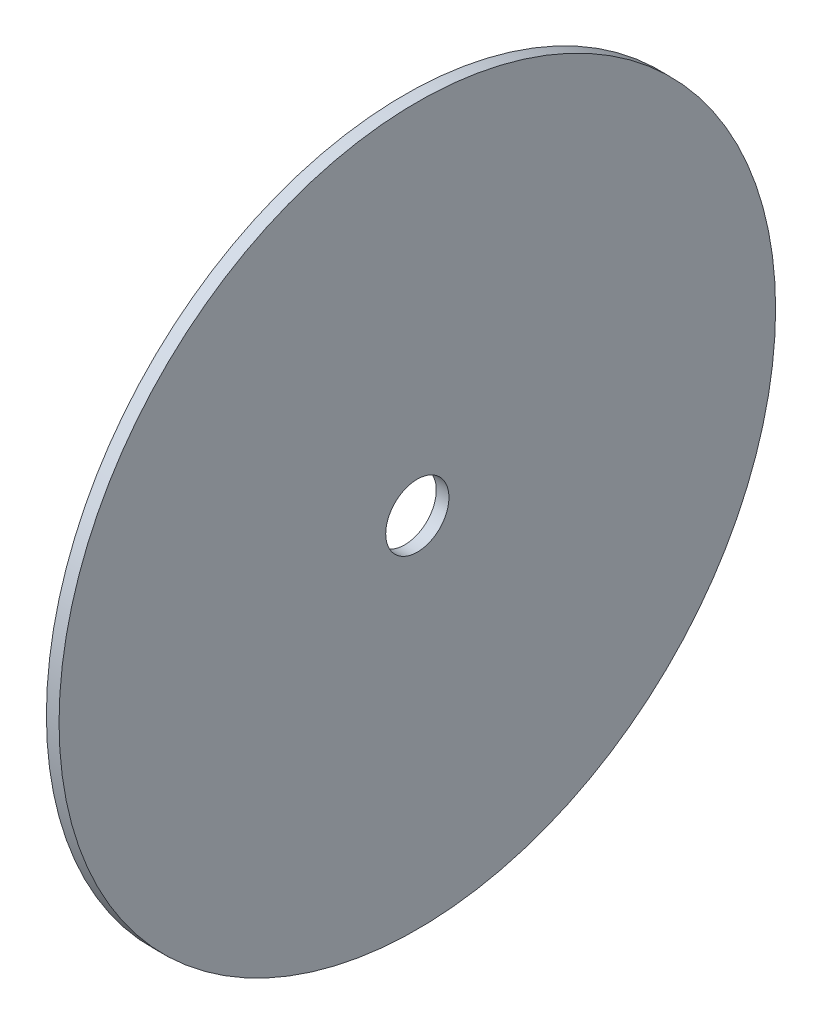
from build123d import *

# Parameters (mm, degrees)
SKETCH_1_W = 0.6
SKETCH_1_H = 15.5


with BuildPart() as part:
    # 草图1 → 旋转1 (revolve)
    with BuildSketch(Plane.XY, mode=Mode.PRIVATE) as revolve_1_sk:
        with Locations((-0.3, 9.25)):
            Rectangle(SKETCH_1_W, SKETCH_1_H)
    revolve(revolve_1_sk.sketch.rotate(Axis((-23.91509434, 0, 0), (1, 0, 0)), 90), axis=Axis((-23.91509434, 0, 0), (1, 0, 0)))


solid = part.part
